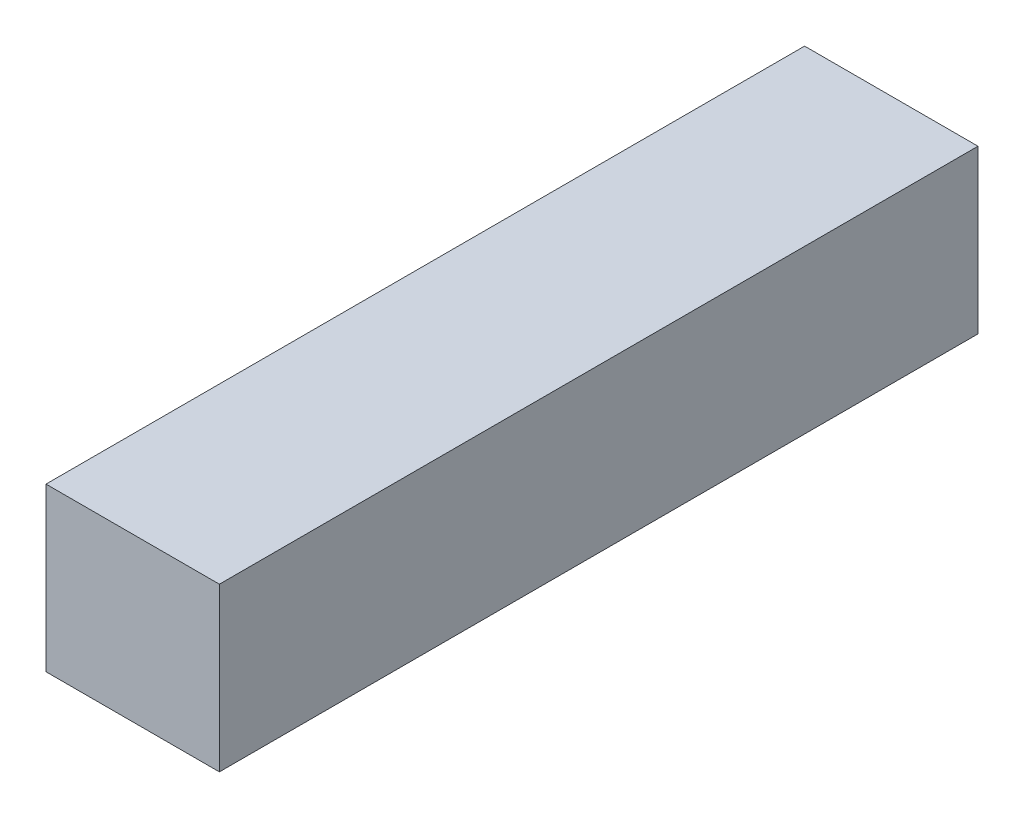
from build123d import *

# Parameters (mm, degrees)
SKETCH_1_W      = 64
SKETCH_1_H      = 60
EXTRUDE_1_DEPTH = 280


with BuildPart() as part:
    # 草图1 → 凸台-拉伸1 (new body)
    with BuildSketch(Plane.XY):
        Rectangle(SKETCH_1_W, SKETCH_1_H)
    extrude(amount=EXTRUDE_1_DEPTH)


solid = part.part
